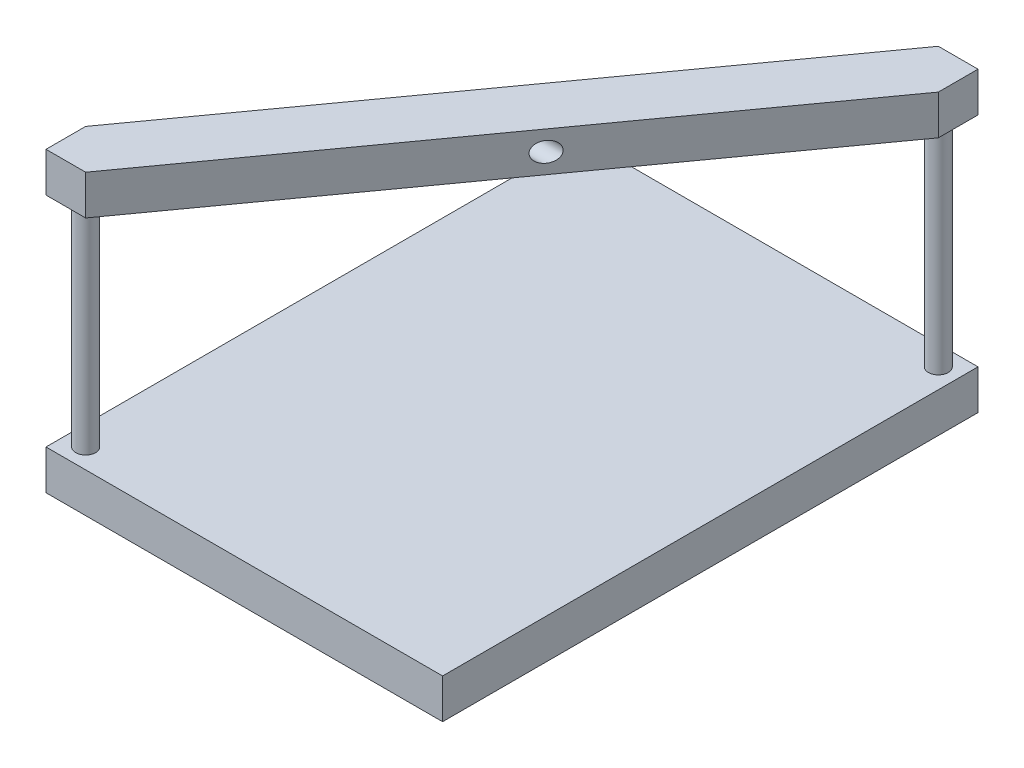
from build123d import *

# Parameters (mm, degrees)
SKETCH1_W                    = 100
SKETCH1_H                    = 135
BOTTOMPLATE_DEPTH            = 10
SKETCH2_R                    = 2.5
TOPPLATFORMSUPPORT_DEPTH     = 55
TOPTHREADEDRODPLATFORM_DEPTH = 10
CUT_EXTRUDE2_REACH           = 185.984
SKETCH5_R                    = 2.5


with BuildPart() as part:
    # Sketch1 → BottomPlate (new body)
    with BuildSketch(Plane(origin=(0, 0, 0), x_dir=(1, 0, 0), z_dir=(0, 1, 0))):
        with Locations((50, 67.5)):
            Rectangle(SKETCH1_W, SKETCH1_H)
    extrude(amount=BOTTOMPLATE_DEPTH)

    # Sketch2 → TopPlatformSupport (add)
    with BuildSketch(Plane(origin=(0, 10, 0), x_dir=(1, 0, 0), z_dir=(0, 1, 0))):
        with Locations(Location((95, 130, 0), (0, 0, 90))):
            Circle(SKETCH2_R)
        with Locations(Location((5, 5, 0), (0, 0, 90))):
            Circle(SKETCH2_R)
    extrude(amount=TOPPLATFORMSUPPORT_DEPTH)

    # Sketch3 → TopThreadedRodPlatform (add)
    with BuildSketch(Plane(origin=(0, 65, 0), x_dir=(1, 0, 0), z_dir=(0, 1, 0))):
        Polygon((90, 135), (0, 10), (0, 0), (10, 0), (100, 125), (100, 135), align=None)
    extrude(amount=TOPTHREADEDRODPLATFORM_DEPTH)

    # Cut-Extrude2: up to this plane
    cut_extrude2_end = Plane(origin=(90, 75, -135), z_dir=(0.8115343414514944, 0, 0.584304725845076))
    # Sketch5 → Cut-Extrude2 (cut, up to the surface)
    with BuildSketch(Plane(origin=(100, 0, 0), x_dir=(0, 0, -1), z_dir=(1, 0, 0)), mode=Mode.PRIVATE) as cut_extrude2_sk1:
        with Locations((67.5, 70)):
            Circle(SKETCH5_R)
    cut_extrude2_tool1 = split(extrude(cut_extrude2_sk1.sketch, amount=-CUT_EXTRUDE2_REACH, mode=Mode.PRIVATE), bisect_by=cut_extrude2_end, keep=Keep.BOTH, mode=Mode.PRIVATE)
    add(cut_extrude2_tool1.solids().sort_by_distance((100, 70, -67.5))[0], mode=Mode.SUBTRACT)


solid = part.part
